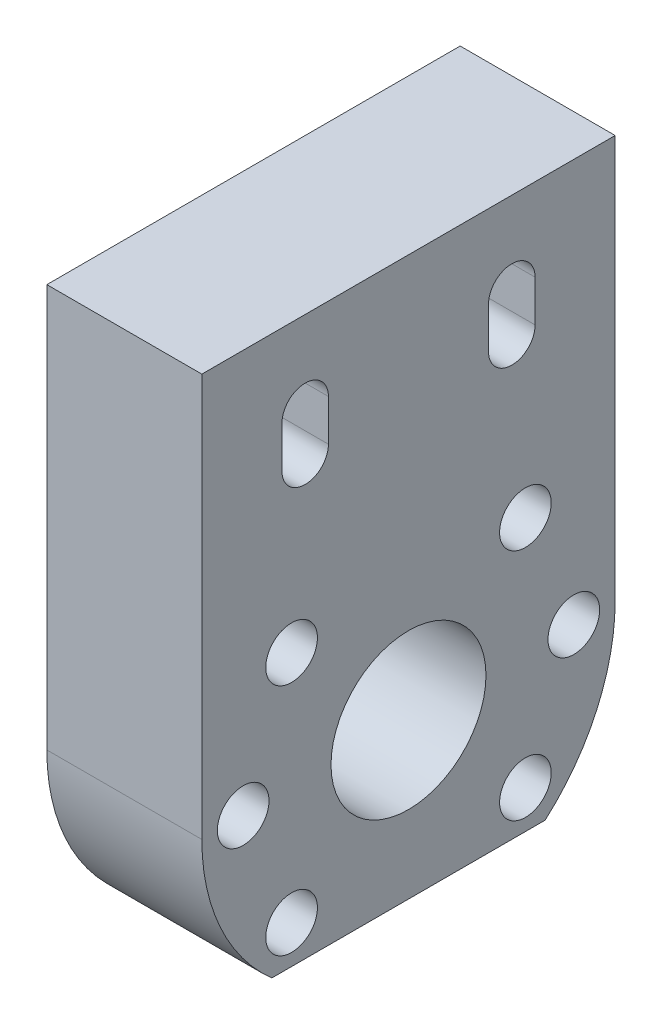
from build123d import *

# Parameters (mm, degrees)
SKETCH1_R           = 7.5
SKETCH1_R_2         = 2.5
BOSS_EXTRUDE1_DEPTH = 15


with BuildPart() as part:
    # Sketch1 → Boss-Extrude1 (new body)
    with BuildSketch(Plane(origin=(0, 0, 0), x_dir=(0, 0, -1), z_dir=(1, 0, 0))):
        with BuildLine():
            Line((-13.228756555, -15), (13.228756555, -15))
            ThreePointArc((13.228756555, -15), (18.228756555, -8.228756555), (20, 0))
            Line((20, 0), (20, 39))
            Line((20, 39), (-20, 39))
            Line((-20, 39), (-20, 0))
            ThreePointArc((-20, 0), (-18.228756555, -8.228756555), (-13.228756555, -15))
        make_face()
        Circle(SKETCH1_R, mode=Mode.SUBTRACT)
        with Locations((16, 0)):
            Circle(SKETCH1_R_2, mode=Mode.SUBTRACT)
        with Locations((11.313708499, -11.313708499)):
            Circle(SKETCH1_R_2, mode=Mode.SUBTRACT)
        with Locations((-11.313708499, -11.313708499)):
            Circle(SKETCH1_R_2, mode=Mode.SUBTRACT)
        with Locations((-16, 0)):
            Circle(SKETCH1_R_2, mode=Mode.SUBTRACT)
        with Locations((-11.313708499, 11.313708499)):
            Circle(SKETCH1_R_2, mode=Mode.SUBTRACT)
        with Locations((11.313708499, 11.313708499)):
            Circle(SKETCH1_R_2, mode=Mode.SUBTRACT)
        with BuildLine():
            Line((-12.25, 27), (-12.25, 31))
            ThreePointArc((-12.25, 31), (-10, 33.25), (-7.75, 31))
            Line((-7.75, 31), (-7.75, 27))
            ThreePointArc((-7.75, 27), (-10, 24.75), (-12.25, 27))
        make_face(mode=Mode.SUBTRACT)
        with BuildLine():
            Line((12.25, 27), (12.25, 31))
            ThreePointArc((12.25, 31), (10, 33.25), (7.75, 31))
            Line((7.75, 31), (7.75, 27))
            ThreePointArc((7.75, 27), (10, 24.75), (12.25, 27))
        make_face(mode=Mode.SUBTRACT)
    extrude(amount=BOSS_EXTRUDE1_DEPTH)


solid = part.part
